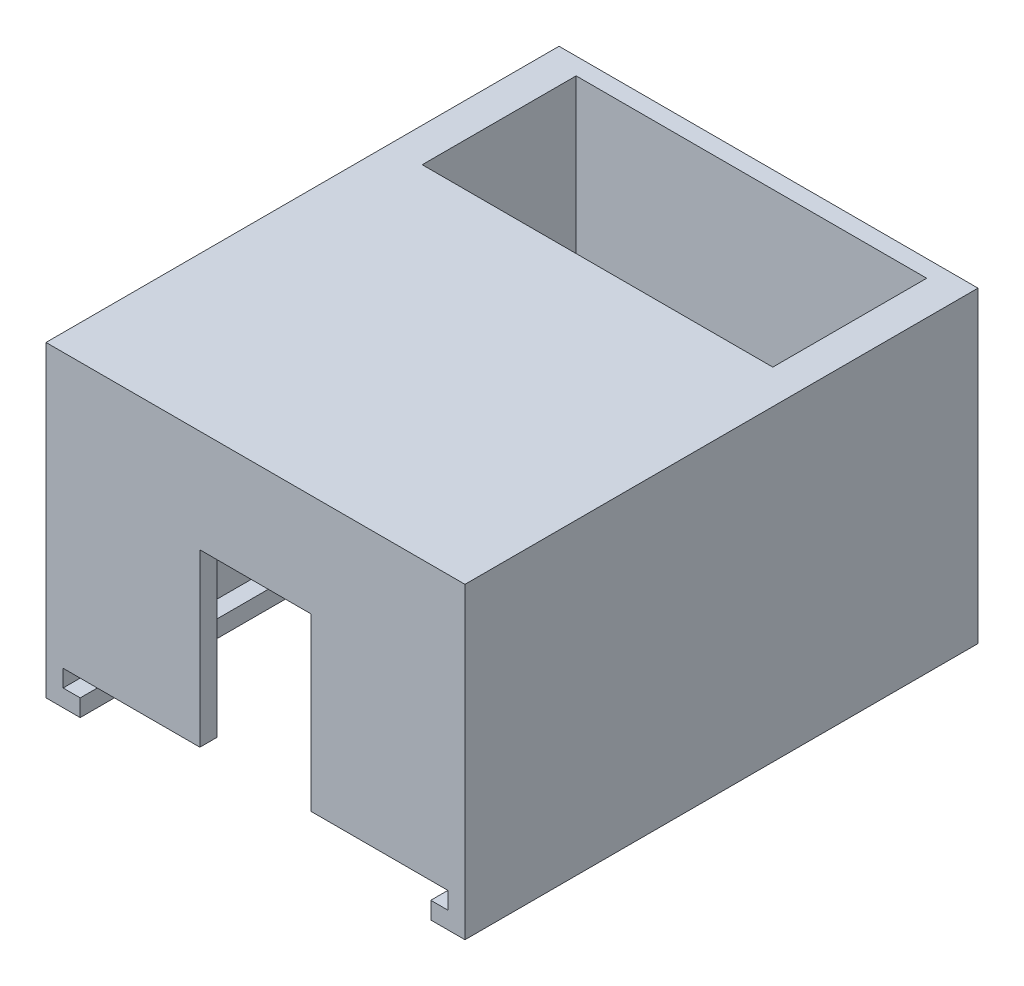
from build123d import *

# Parameters (mm, degrees)
ESQUISSE1_W                  = 24.5
ESQUISSE1_H                  = 18
BOSS_EXTRU_3_DEPTH           = 30
ENL_V_MAT_EXTRU_1_DEPTH      = 43.711239739
ENL_V_MAT_EXTRU_1_DEPTH_BACK = 29
ENL_V_MAT_EXTRU_2_DEPTH      = 1
ESQUISSE6_W                  = 29
ESQUISSE6_H                  = 1
ENL_V_MAT_EXTRU_3_DEPTH      = 1
ESQUISSE7_W                  = 20.5
ESQUISSE7_H                  = 15
BOSS_EXTRU_4_DEPTH           = 1
ESQUISSE8_W                  = 6.5
ESQUISSE8_H                  = 10
ENL_V_MAT_EXTRU_4_DEPTH      = 1
ESQUISSE10_W                 = 20.5
ESQUISSE10_H                 = 9
ENL_V_MAT_EXTRU_5_DEPTH      = 43.299527184


with BuildPart() as part:
    # Esquisse1 → Boss.-Extru.3 (new body)
    with BuildSketch(Plane.XY):
        with Locations((12.25, 9)):
            Rectangle(ESQUISSE1_W, ESQUISSE1_H)
    extrude(amount=BOSS_EXTRU_3_DEPTH)

    # Esquisse4 → Enlèv. mat.-Extru.1 (cut, two sides: drawn at the far end of the back side and taken through both)
    with BuildSketch(Plane.XY.offset(30).offset(-ENL_V_MAT_EXTRU_1_DEPTH_BACK)):
        Polygon((22.5, -67.628118137), (22.5, 0), (22.5, 17), (2, 17), (2, 0), (2, -67.628118137), (2, -202.884354411), (22.5, -202.884354411), align=None)
    extrude(amount=ENL_V_MAT_EXTRU_1_DEPTH + ENL_V_MAT_EXTRU_1_DEPTH_BACK, mode=Mode.SUBTRACT)

    # Esquisse5 → Enlèv. mat.-Extru.2 (cut)
    with BuildSketch(Plane(origin=(2, 0, 0), x_dir=(0, 0, -1), z_dir=(1, 0, 0))):
        Polygon((-1, 1), (-30, 1), (-30, 2), (-2, 2), (-1, 2), align=None)
    extrude(amount=-ENL_V_MAT_EXTRU_2_DEPTH, mode=Mode.SUBTRACT)

    # Esquisse6 → Enlèv. mat.-Extru.3 (cut)
    with BuildSketch(Plane.ZY.offset(-22.5)):
        with Locations((15.5, 1.5)):
            Rectangle(ESQUISSE6_W, ESQUISSE6_H)
    extrude(amount=-ENL_V_MAT_EXTRU_3_DEPTH, mode=Mode.SUBTRACT)

    # Esquisse7 → Boss.-Extru.4 (add)
    with BuildSketch(Plane.XY.offset(30)):
        with Locations((12.25, 9.5)):
            Rectangle(ESQUISSE7_W, ESQUISSE7_H)
    extrude(amount=-BOSS_EXTRU_4_DEPTH)

    # Esquisse8 → Enlèv. mat.-Extru.4 (cut)
    with BuildSketch(Plane.XY.offset(30)):
        with Locations((12.25, 7)):
            Rectangle(ESQUISSE8_W, ESQUISSE8_H)
    extrude(amount=-ENL_V_MAT_EXTRU_4_DEPTH, mode=Mode.SUBTRACT)

    # Esquisse10 → Enlèv. mat.-Extru.5 (cut, through all)
    with BuildSketch(Plane(origin=(0, 17, 0), x_dir=(-1, 0, 0), z_dir=(0, -1, 0))):
        with Locations((-12.25, -5.5)):
            Rectangle(ESQUISSE10_W, ESQUISSE10_H)
    extrude(amount=-ENL_V_MAT_EXTRU_5_DEPTH, mode=Mode.SUBTRACT)


solid = part.part
